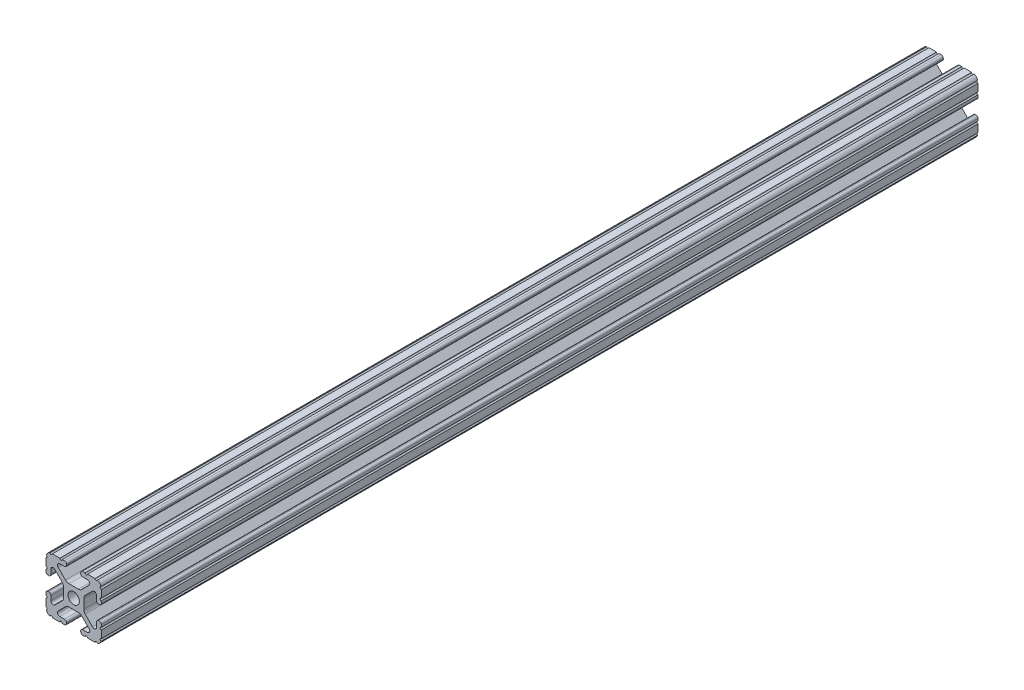
from build123d import *
from build123d.topology import SkipClean

# Parameters (mm, degrees)
BOSS_EXTRUDE1_DEPTH     = 113.37
CUT_EXTRUDE1_DEPTH      = 115.783870383
CUT_EXTRUDE1_DEPTH_BACK = 115.783870383
SKETCH5_R               = 0.55245
BOSS_EXTRUDE2_START     = 175.92
SKETCH6_R               = 2.6035
BOSS_EXTRUDE2_DEPTH     = 175.92


with BuildPart() as part:
    # Sketch4 → Boss-Extrude1 (new, symmetric)
    with BuildSketch(Plane.XY):
        with BuildLine():
            Line((4.190365, -12.7), (10.11729625, -12.7))
            ThreePointArc((10.11729625, -12.7), (11.943543585, -11.943543585), (12.7, -10.11729625))
            Line((12.7, -10.11729625), (12.7, -4.190365))
            ThreePointArc((12.7, -4.190365), (12.42492494, -3.52627506), (11.760835, -3.2512))
            Line((11.760835, -3.2512), (11.429365, -3.2512))
            ThreePointArc((11.429365, -3.2512), (10.76527506, -3.52627506), (10.4902, -4.190365))
            Line((10.4902, -4.190365), (10.4902, -6.348478019))
            ThreePointArc((10.4902, -6.348478019), (9.830707141, -7.335478831), (8.666460301, -7.103895736))
            Line((8.666460301, -7.103895736), (5.299899128, -3.737334563))
            ThreePointArc((5.299899128, -3.737334563), (4.817571085, -3.015479634), (4.6482, -2.16399369))
            Line((4.6482, -2.16399369), (4.6482, 0))
            Line((4.6482, 0), (2.6035, 0))
            ThreePointArc((2.6035, 0), (1.840952505, -1.840952505), (0, -2.6035))
            Line((0, -2.6035), (0, -4.6482))
            Line((0, -4.6482), (2.16399369, -4.6482))
            ThreePointArc((2.16399369, -4.6482), (3.015479634, -4.817571085), (3.737334563, -5.299899128))
            Line((3.737334563, -5.299899128), (7.103895736, -8.666460301))
            ThreePointArc((7.103895736, -8.666460301), (7.335478831, -9.830707141), (6.348478019, -10.4902))
            Line((6.348478019, -10.4902), (4.190365, -10.4902))
            ThreePointArc((4.190365, -10.4902), (3.52627506, -10.76527506), (3.2512, -11.429365))
            Line((3.2512, -11.429365), (3.2512, -11.760835))
            ThreePointArc((3.2512, -11.760835), (3.52627506, -12.42492494), (4.190365, -12.7))
        make_face()
    extrude(amount=BOSS_EXTRUDE1_DEPTH, both=True)

    # Sketch5 → Cut-Extrude1 (cut, two sides: drawn at the far end of the back side and taken through both)
    with BuildSketch(Plane.XY.offset(-CUT_EXTRUDE1_DEPTH_BACK)):
        with Locations((10.356153152, -12.7)):
            Circle(SKETCH5_R)
        with Locations((5.796028019, -12.7)):
            Circle(SKETCH5_R)
        with Locations((12.7, -10.356153152)):
            Circle(SKETCH5_R)
        with Locations((12.7, -5.796028019)):
            Circle(SKETCH5_R)
    extrude(amount=CUT_EXTRUDE1_DEPTH + CUT_EXTRUDE1_DEPTH_BACK, mode=Mode.SUBTRACT)

    # Mirror1: part across plane


with BuildPart() as part_1:
    add(part.part)
    add(part.part.mirror(Plane(origin=(0, 0, 0), x_dir=(0, 0, 1), z_dir=(1, 0, 0))))

    # Mirror2: part across plane


with BuildPart() as part_2:
    add(part_1.part)
    add(part_1.part.mirror(Plane.ZX))

    # Sketch6 → Boss-Extrude2 (add)
    with SkipClean():  # the faces are left unmerged after this step: merging them gives an invalid solid
        with BuildSketch(Plane.XY.offset(113.37).offset(BOSS_EXTRUDE2_START)):
            with BuildLine():
                Line((12.7, -5.243578019), (12.7, -4.190365))
                ThreePointArc((12.7, -4.190365), (12.42492494, -3.52627506), (11.760835, -3.2512))
                Line((11.760835, -3.2512), (11.429365, -3.2512))
                ThreePointArc((11.429365, -3.2512), (10.76527506, -3.52627506), (10.4902, -4.190365))
                Line((10.4902, -4.190365), (10.4902, -6.348478019))
                ThreePointArc((10.4902, -6.348478019), (9.830707141, -7.335478831), (8.666460301, -7.103895736))
                Line((8.666460301, -7.103895736), (5.299899128, -3.737334563))
                ThreePointArc((5.299899128, -3.737334563), (4.817571085, -3.015479634), (4.6482, -2.16399369))
                Line((4.6482, -2.16399369), (4.6482, 2.16399369))
                ThreePointArc((4.6482, 2.16399369), (4.817571085, 3.015479634), (5.299899128, 3.737334563))
                Line((5.299899128, 3.737334563), (8.666460301, 7.103895736))
                ThreePointArc((8.666460301, 7.103895736), (9.830707141, 7.335478831), (10.4902, 6.348478019))
                Line((10.4902, 6.348478019), (10.4902, 4.190365))
                ThreePointArc((10.4902, 4.190365), (10.76527506, 3.52627506), (11.429365, 3.2512))
                Line((11.429365, 3.2512), (11.760835, 3.2512))
                ThreePointArc((11.760835, 3.2512), (12.42492494, 3.52627506), (12.7, 4.190365))
                Line((12.7, 4.190365), (12.7, 5.243578019))
                ThreePointArc((12.7, 5.243578019), (12.14755, 5.796028019), (12.7, 6.348478019))
                Line((12.7, 6.348478019), (12.7, 9.803703152))
                ThreePointArc((12.7, 9.803703152), (12.150857656, 10.295790178), (12.579996867, 10.895412135))
                ThreePointArc((12.579996867, 10.895412135), (11.943543585, 11.943543585), (10.895412135, 12.579996867))
                ThreePointArc((10.895412135, 12.579996867), (10.295790178, 12.150857656), (9.803703152, 12.7))
                Line((9.803703152, 12.7), (6.348478019, 12.7))
                ThreePointArc((6.348478019, 12.7), (5.796028019, 12.14755), (5.243578019, 12.7))
                Line((5.243578019, 12.7), (4.190365, 12.7))
                ThreePointArc((4.190365, 12.7), (3.52627506, 12.42492494), (3.2512, 11.760835))
                Line((3.2512, 11.760835), (3.2512, 11.429365))
                ThreePointArc((3.2512, 11.429365), (3.52627506, 10.76527506), (4.190365, 10.4902))
                Line((4.190365, 10.4902), (6.348478019, 10.4902))
                ThreePointArc((6.348478019, 10.4902), (7.335478831, 9.830707141), (7.103895736, 8.666460301))
                Line((7.103895736, 8.666460301), (3.737334563, 5.299899128))
                ThreePointArc((3.737334563, 5.299899128), (3.015479634, 4.817571085), (2.16399369, 4.6482))
                Line((2.16399369, 4.6482), (-2.16399369, 4.6482))
                ThreePointArc((-2.16399369, 4.6482), (-3.015479634, 4.817571085), (-3.737334563, 5.299899128))
                Line((-3.737334563, 5.299899128), (-7.103895736, 8.666460301))
                ThreePointArc((-7.103895736, 8.666460301), (-7.335478831, 9.830707141), (-6.348478019, 10.4902))
                Line((-6.348478019, 10.4902), (-4.190365, 10.4902))
                ThreePointArc((-4.190365, 10.4902), (-3.52627506, 10.76527506), (-3.2512, 11.429365))
                Line((-3.2512, 11.429365), (-3.2512, 11.760835))
                ThreePointArc((-3.2512, 11.760835), (-3.52627506, 12.42492494), (-4.190365, 12.7))
                Line((-4.190365, 12.7), (-5.243578019, 12.7))
                ThreePointArc((-5.243578019, 12.7), (-5.796028019, 12.14755), (-6.348478019, 12.7))
                Line((-6.348478019, 12.7), (-9.803703152, 12.7))
                ThreePointArc((-9.803703152, 12.7), (-10.295790178, 12.150857656), (-10.895412135, 12.579996867))
                ThreePointArc((-10.895412135, 12.579996867), (-11.943543585, 11.943543585), (-12.579996867, 10.895412135))
                ThreePointArc((-12.579996867, 10.895412135), (-12.150857656, 10.295790178), (-12.7, 9.803703152))
                Line((-12.7, 9.803703152), (-12.7, 6.348478019))
                ThreePointArc((-12.7, 6.348478019), (-12.14755, 5.796028019), (-12.7, 5.243578019))
                Line((-12.7, 5.243578019), (-12.7, 4.190365))
                ThreePointArc((-12.7, 4.190365), (-12.42492494, 3.52627506), (-11.760835, 3.2512))
                Line((-11.760835, 3.2512), (-11.429365, 3.2512))
                ThreePointArc((-11.429365, 3.2512), (-10.76527506, 3.52627506), (-10.4902, 4.190365))
                Line((-10.4902, 4.190365), (-10.4902, 6.348478019))
                ThreePointArc((-10.4902, 6.348478019), (-9.830707141, 7.335478831), (-8.666460301, 7.103895736))
                Line((-8.666460301, 7.103895736), (-5.299899128, 3.737334563))
                ThreePointArc((-5.299899128, 3.737334563), (-4.817571085, 3.015479634), (-4.6482, 2.16399369))
                Line((-4.6482, 2.16399369), (-4.6482, -2.16399369))
                ThreePointArc((-4.6482, -2.16399369), (-4.817571085, -3.015479634), (-5.299899128, -3.737334563))
                Line((-5.299899128, -3.737334563), (-8.666460301, -7.103895736))
                ThreePointArc((-8.666460301, -7.103895736), (-9.830707141, -7.335478831), (-10.4902, -6.348478019))
                Line((-10.4902, -6.348478019), (-10.4902, -4.190365))
                ThreePointArc((-10.4902, -4.190365), (-10.76527506, -3.52627506), (-11.429365, -3.2512))
                Line((-11.429365, -3.2512), (-11.760835, -3.2512))
                ThreePointArc((-11.760835, -3.2512), (-12.42492494, -3.52627506), (-12.7, -4.190365))
                Line((-12.7, -4.190365), (-12.7, -5.243578019))
                ThreePointArc((-12.7, -5.243578019), (-12.14755, -5.796028019), (-12.7, -6.348478019))
                Line((-12.7, -6.348478019), (-12.7, -9.803703152))
                ThreePointArc((-12.7, -9.803703152), (-12.150857656, -10.295790178), (-12.579996867, -10.895412135))
                ThreePointArc((-12.579996867, -10.895412135), (-11.943543585, -11.943543585), (-10.895412135, -12.579996867))
                ThreePointArc((-10.895412135, -12.579996867), (-10.295790178, -12.150857656), (-9.803703152, -12.7))
                Line((-9.803703152, -12.7), (-6.348478019, -12.7))
                ThreePointArc((-6.348478019, -12.7), (-5.796028019, -12.14755), (-5.243578019, -12.7))
                Line((-5.243578019, -12.7), (-4.190365, -12.7))
                ThreePointArc((-4.190365, -12.7), (-3.52627506, -12.42492494), (-3.2512, -11.760835))
                Line((-3.2512, -11.760835), (-3.2512, -11.429365))
                ThreePointArc((-3.2512, -11.429365), (-3.52627506, -10.76527506), (-4.190365, -10.4902))
                Line((-4.190365, -10.4902), (-6.348478019, -10.4902))
                ThreePointArc((-6.348478019, -10.4902), (-7.335478831, -9.830707141), (-7.103895736, -8.666460301))
                Line((-7.103895736, -8.666460301), (-3.737334563, -5.299899128))
                ThreePointArc((-3.737334563, -5.299899128), (-3.015479634, -4.817571085), (-2.16399369, -4.6482))
                Line((-2.16399369, -4.6482), (2.16399369, -4.6482))
                ThreePointArc((2.16399369, -4.6482), (3.015479634, -4.817571085), (3.737334563, -5.299899128))
                Line((3.737334563, -5.299899128), (7.103895736, -8.666460301))
                ThreePointArc((7.103895736, -8.666460301), (7.335478831, -9.830707141), (6.348478019, -10.4902))
                Line((6.348478019, -10.4902), (4.190365, -10.4902))
                ThreePointArc((4.190365, -10.4902), (3.52627506, -10.76527506), (3.2512, -11.429365))
                Line((3.2512, -11.429365), (3.2512, -11.760835))
                ThreePointArc((3.2512, -11.760835), (3.52627506, -12.42492494), (4.190365, -12.7))
                Line((4.190365, -12.7), (5.243578019, -12.7))
                ThreePointArc((5.243578019, -12.7), (5.796028019, -12.14755), (6.348478019, -12.7))
                Line((6.348478019, -12.7), (9.803703152, -12.7))
                ThreePointArc((9.803703152, -12.7), (10.295790178, -12.150857656), (10.895412135, -12.579996867))
                ThreePointArc((10.895412135, -12.579996867), (11.943543585, -11.943543585), (12.579996867, -10.895412135))
                ThreePointArc((12.579996867, -10.895412135), (12.150857656, -10.295790178), (12.7, -9.803703152))
                Line((12.7, -9.803703152), (12.7, -6.348478019))
                ThreePointArc((12.7, -6.348478019), (12.14755, -5.796028019), (12.7, -5.243578019))
            make_face()
            Circle(SKETCH6_R, mode=Mode.SUBTRACT)
        extrude(amount=-BOSS_EXTRUDE2_DEPTH)


solid = part_2.part
